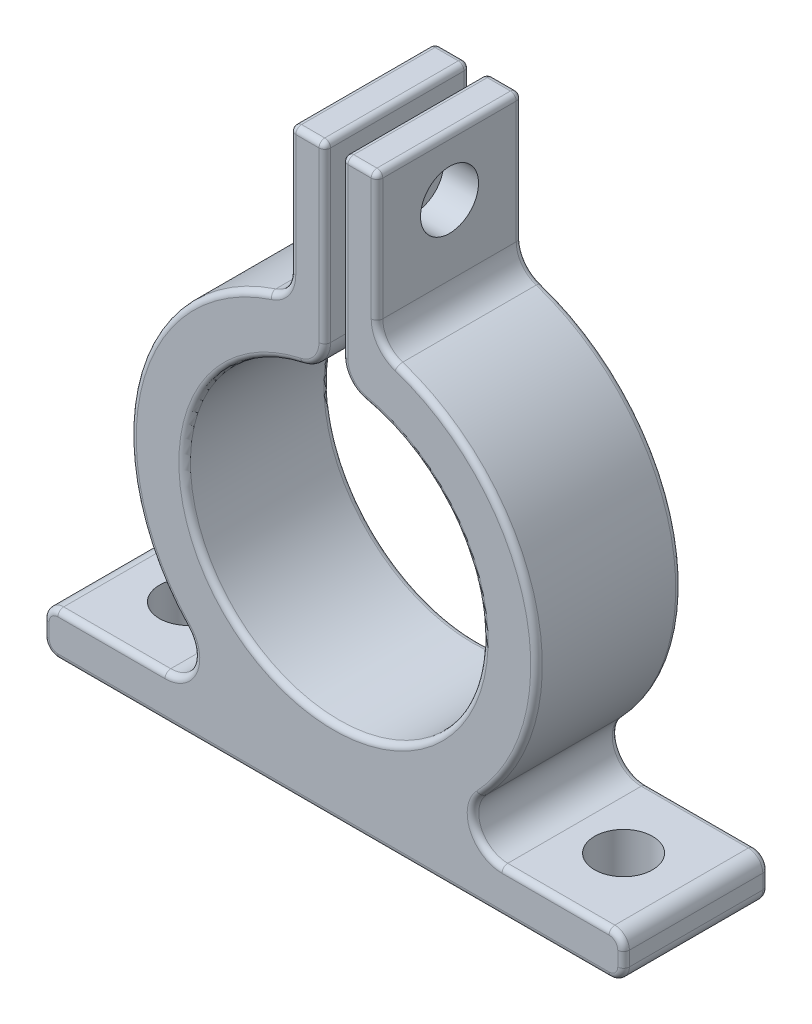
from build123d import *

# Parameters (mm, degrees)
EXTRUDE_1_DEPTH     = 5
CUT_EXTRUDE_1_REACH = 23.616
SKETCH_3_R          = 1
CUT_EXTRUDE_2_REACH = 19.357
SKETCH_4_R          = 1
FILLET_2_R          = 0.2


with BuildPart() as part:
    # 草图1 → 凸台-拉伸1 (new body)
    with BuildSketch(Plane.XY):
        with BuildLine():
            Line((-9.5, -6.5), (-5.809475019, -6.5))
            ThreePointArc((-5.809475019, -6.5), (-4.890916366, -5.895284708), (-5.083290642, -4.8125))
            ThreePointArc((-5.083290642, -4.8125), (-6.786753746, 1.714635121), (-2.1875, 6.649424317))
            ThreePointArc((-2.1875, 6.649424317), (-1.689907413, 7.013040107), (-1.5, 7.599342077))
            Line((-1.5, 7.599342077), (-1.5, 11.8))
            ThreePointArc((-1.5, 11.8), (-1.441421356, 11.941421356), (-1.3, 12))
            Line((-1.3, 12), (-0.5, 12))
            ThreePointArc((-0.5, 12), (-0.358578644, 11.941421356), (-0.3, 11.8))
            Line((-0.3, 11.8), (-0.3, 5.991387134))
            ThreePointArc((-0.3, 5.991387134), (-0.521525828, 5.363710495), (-1.087955926, 5.01412703))
            ThreePointArc((-1.087955926, 5.01412703), (0, -5.130800909), (1.087955926, 5.01412703))
            ThreePointArc((1.087955926, 5.01412703), (0.521525828, 5.363710495), (0.3, 5.991387134))
            Line((0.3, 5.991387134), (0.3, 11.8))
            ThreePointArc((0.3, 11.8), (0.358578644, 11.941421356), (0.5, 12))
            Line((0.5, 12), (1.3, 12))
            ThreePointArc((1.3, 12), (1.441421356, 11.941421356), (1.5, 11.8))
            Line((1.5, 11.8), (1.5, 7.599342077))
            ThreePointArc((1.5, 7.599342077), (1.689907413, 7.013040107), (2.1875, 6.649424317))
            ThreePointArc((2.1875, 6.649424317), (6.786753746, 1.714635121), (5.083290642, -4.8125))
            ThreePointArc((5.083290642, -4.8125), (4.890916366, -5.895284708), (5.809475019, -6.5))
            Line((5.809475019, -6.5), (9.5, -6.5))
            ThreePointArc((9.5, -6.5), (9.853553391, -6.646446609), (10, -7))
            Line((10, -7), (10, -7.5))
            ThreePointArc((10, -7.5), (9.853553391, -7.853553391), (9.5, -8))
            Line((9.5, -8), (-9.5, -8))
            ThreePointArc((-9.5, -8), (-9.853553391, -7.853553391), (-10, -7.5))
            Line((-10, -7.5), (-10, -7))
            ThreePointArc((-10, -7), (-9.853553391, -6.646446609), (-9.5, -6.5))
        make_face()
    extrude(amount=EXTRUDE_1_DEPTH)

    # 草图3 → 切除-拉伸1 (cut, up to next)
    with BuildSketch(Plane(origin=(0, -6.5, 0), x_dir=(1, 0, 0), z_dir=(0, 1, 0)), mode=Mode.PRIVATE) as cut_extrude_1_sk1:
        with Locations(Location((-7.5, -2.5, 0), (0, 0, 270))):
            Circle(SKETCH_3_R)
    cut_extrude_1_tool1 = extrude(cut_extrude_1_sk1.sketch, amount=-CUT_EXTRUDE_1_REACH, mode=Mode.PRIVATE) & part.part
    # 草图3 → 切除-拉伸1 (cut, up to next)
    with BuildSketch(Plane(origin=(0, -6.5, 0), x_dir=(1, 0, 0), z_dir=(0, 1, 0)), mode=Mode.PRIVATE) as cut_extrude_1_sk2:
        with Locations(Location((7.5, -2.5, 0), (0, 0, 270))):
            Circle(SKETCH_3_R)
    cut_extrude_1_tool2 = extrude(cut_extrude_1_sk2.sketch, amount=-CUT_EXTRUDE_1_REACH, mode=Mode.PRIVATE) & part.part
    add(cut_extrude_1_tool1.solids().sort_by_distance((-7.5, -6.5, 2.5))[0], mode=Mode.SUBTRACT)
    add(cut_extrude_1_tool2.solids().sort_by_distance((7.5, -6.5, 2.5))[0], mode=Mode.SUBTRACT)

    # 切除-拉伸2: up to this face of the body (flat: up to its plane)
    cut_extrude_2_end = Plane(part.part.faces().sort_by_distance((1.5, 9.699671038, 2.5))[0])
    # 草图4 → 切除-拉伸2 (cut, up to the picked face)
    with BuildSketch(Plane.ZY.offset(1.5), mode=Mode.PRIVATE) as cut_extrude_2_sk1:
        with Locations(Location((2.5, 10, 0), (0, 0, 270))):
            Circle(SKETCH_4_R)
    cut_extrude_2_tool1 = split(extrude(cut_extrude_2_sk1.sketch, amount=-CUT_EXTRUDE_2_REACH, mode=Mode.PRIVATE), bisect_by=cut_extrude_2_end, keep=Keep.BOTH, mode=Mode.PRIVATE)
    add(cut_extrude_2_tool1.solids().sort_by(Axis((-1.5, 10, 2.5), (1, 0, 0)))[0], mode=Mode.SUBTRACT)

    # 圆角2
    fillet_2_edges = [part.edges().sort_by_distance(p)[0] for p in [
        (1.689907413, 7.013040107, 5),
        (1.5, 9.699671038, 5),
        (1.441421356, 11.941421356, 5),
        (0.9, 12, 5),
        (0.358578644, 11.941421356, 5),
        (7.65473751, -6.5, 0),
        (9.853553391, -6.646446609, 0),
        (10, -7.25, 0),
        (9.853553391, -7.853553391, 0),
        (0.3, 8.895693567, 5),
        (0, -8, 0),
        (-9.853553391, -7.853553391, 0),
        (-10, -7.25, 0),
        (-9.853553391, -6.646446609, 0),
        (-7.65473751, -6.5, 0),
        (-4.890916366, -5.895284708, 0),
        (-6.786753746, 1.714635121, 0),
        (0.521525828, 5.363710495, 5),
        (-1.689907413, 7.013040107, 0),
        (-1.5, 9.699671038, 0),
        (-1.441421356, 11.941421356, 0),
        (-0.9, 12, 0),
        (-0.358578644, 11.941421356, 0),
        (-0.3, 8.895693567, 0),
        (-0.521525828, 5.363710495, 0),
        (0, -5.130800909, 0),
        (0, -5.130800909, 5),
        (0.521525828, 5.363710495, 0),
        (0.3, 8.895693567, 0),
        (0.358578644, 11.941421356, 0),
        (0.9, 12, 0),
        (1.441421356, 11.941421356, 0),
        (1.5, 9.699671038, 0),
        (1.689907413, 7.013040107, 0),
        (-0.521525828, 5.363710495, 5),
        (6.786753746, 1.714635121, 0),
        (4.890916366, -5.895284708, 0),
        (-0.3, 8.895693567, 5),
        (4.890916366, -5.895284708, 5),
        (-0.358578644, 11.941421356, 5),
        (-0.9, 12, 5),
        (-1.441421356, 11.941421356, 5),
        (-1.5, 9.699671038, 5),
        (-1.689907413, 7.013040107, 5),
        (-6.786753746, 1.714635121, 5),
        (-4.890916366, -5.895284708, 5),
        (-7.65473751, -6.5, 5),
        (-9.853553391, -6.646446609, 5),
        (-10, -7.25, 5),
        (6.786753746, 1.714635121, 5),
        (-9.853553391, -7.853553391, 5),
        (0, -8, 5),
        (9.853553391, -7.853553391, 5),
        (10, -7.25, 5),
        (9.853553391, -6.646446609, 5),
        (7.65473751, -6.5, 5),
    ]]
    fillet(fillet_2_edges, radius=FILLET_2_R)


solid = part.part
